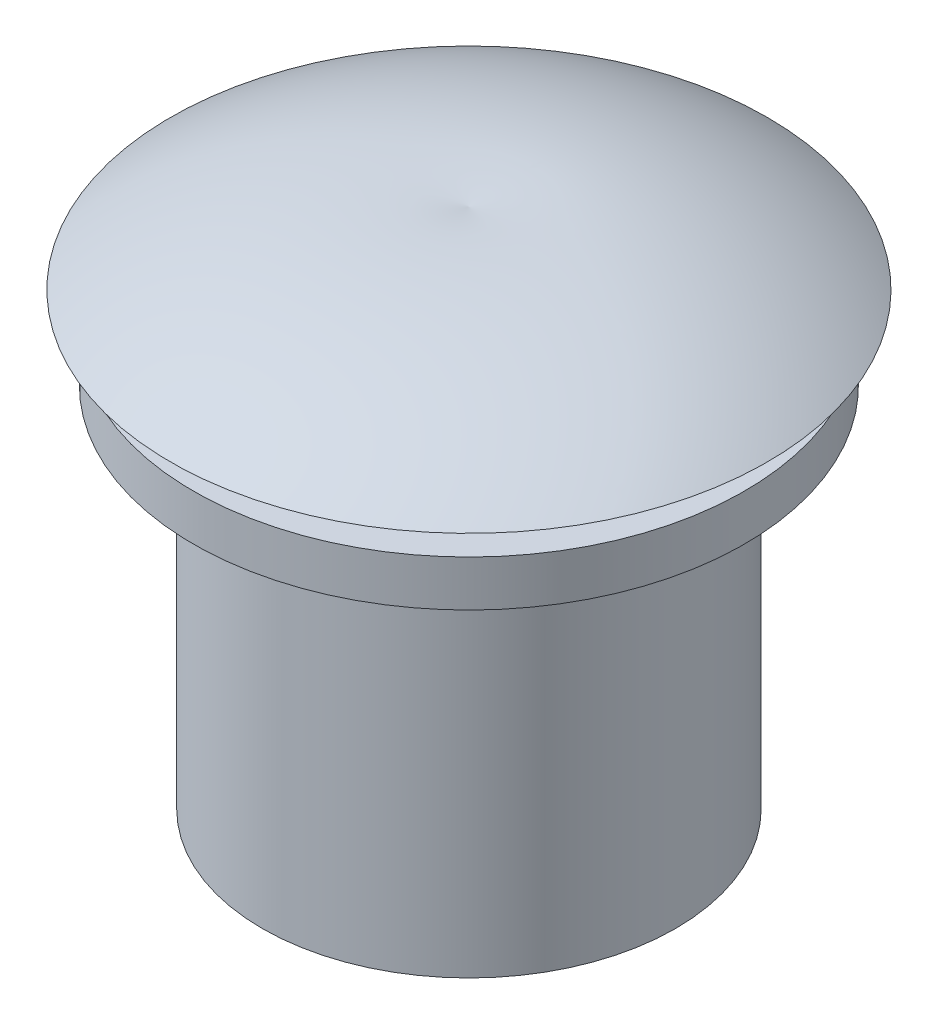
from build123d import *


with BuildPart() as part:
    # Sketch1 → Revolve1 (revolve)
    with BuildSketch(Plane.XY, mode=Mode.PRIVATE) as revolve1_sk:
        with BuildLine():
            Line((0, 0), (0.22225, 0))
            Line((0.22225, 0), (0.22225, 0.8001))
            Line((0.22225, 0.8001), (0.34925, 0.8001))
            Line((0.34925, 0.8001), (0.34925, 0))
            Line((0.34925, 0), (0.5715, 0))
            Line((0.5715, 0), (0.5715, 1.016))
            Line((0.5715, 1.016), (0.762, 1.016))
            Line((0.762, 1.016), (0.762, 1.143))
            Line((0.762, 1.143), (0.508, 1.143))
            Line((0.508, 1.143), (0.508, 1.2446))
            Line((0.508, 1.2446), (0.8255, 1.2446))
            ThreePointArc((0.8255, 1.2446), (0.430950097, 1.419588625), (0, 1.443518904))
            Line((0, 1.443518904), (0, 0))
        make_face()
    revolve(revolve1_sk.sketch.rotate(Axis((0, 0, 0), (0, 1, 0)), 90), axis=Axis((0, 0, 0), (0, 1, 0)))


solid = part.part
